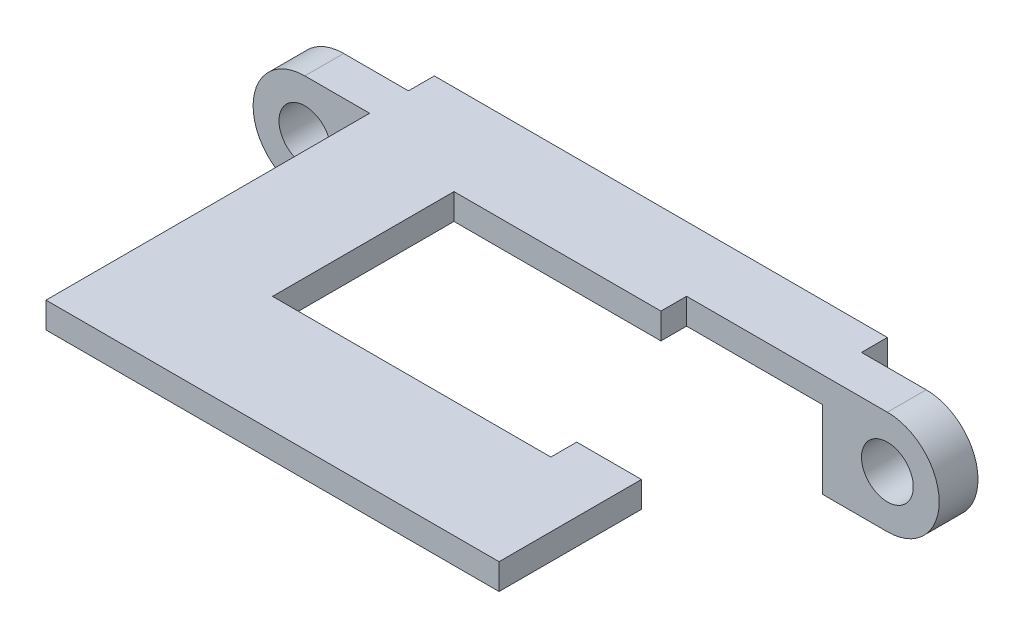
from build123d import *

# Parameters (mm, degrees)
SALIENTE_EXTRUIR3_DEPTH = 2
SALIENTE_EXTRUIR4_START = -2
CROQUIS3_R              = 2
SALIENTE_EXTRUIR4_DEPTH = 3


with BuildPart() as part:
    # Croquis1 → Saliente-Extruir3 (new body)
    with BuildSketch(Plane(origin=(0, 0, 0), x_dir=(1, 0, 0), z_dir=(0, 1, 0))):
        Polygon((-17.5, 5), (-17.5, -5), (-17.5, -15), (17.5, -15), (17.5, -6), (17.5, -4), (12.5, -4), (12.5, -6), (-9, -6), (-9, 8.019718755), (6.986881597, 8.019718755), (6.986881597, 10), (17.5, 10), (17.5, 15), (5, 15), (-5, 15), (-17.5, 15), align=None)
    extrude(amount=SALIENTE_EXTRUIR3_DEPTH)

    # Croquis3 → Saliente-Extruir4 (add)
    # profile 1 of 2: a face of its own
    with BuildSketch(Plane(origin=(0, 0, -15), x_dir=(-1, 0, 0), z_dir=(0, 0, -1)).offset(SALIENTE_EXTRUIR4_START)):
        with BuildLine():
            Line((-17.5, 2), (-17.5, -6))
            Line((-17.5, -6), (-22.5, -6))
            ThreePointArc((-22.5, -6), (-26.5, -2), (-22.5, 2))
            Line((-22.5, 2), (-17.5, 2))
        make_face()
        with Locations((-22.5, -2)):
            Circle(CROQUIS3_R, mode=Mode.SUBTRACT)
    # profile 2 of 2: a face of its own
    with BuildSketch(Plane(origin=(0, 0, -15), x_dir=(-1, 0, 0), z_dir=(0, 0, -1)).offset(SALIENTE_EXTRUIR4_START)):
        with BuildLine():
            Line((17.5, 2), (17.5, -6))
            Line((17.5, -6), (22.5, -6))
            ThreePointArc((22.5, -6), (26.5, -2), (22.5, 2))
            Line((22.5, 2), (17.5, 2))
        make_face()
        with Locations((22.5, -2)):
            Circle(CROQUIS3_R, mode=Mode.SUBTRACT)
    extrude(amount=-SALIENTE_EXTRUIR4_DEPTH)


solid = part.part
